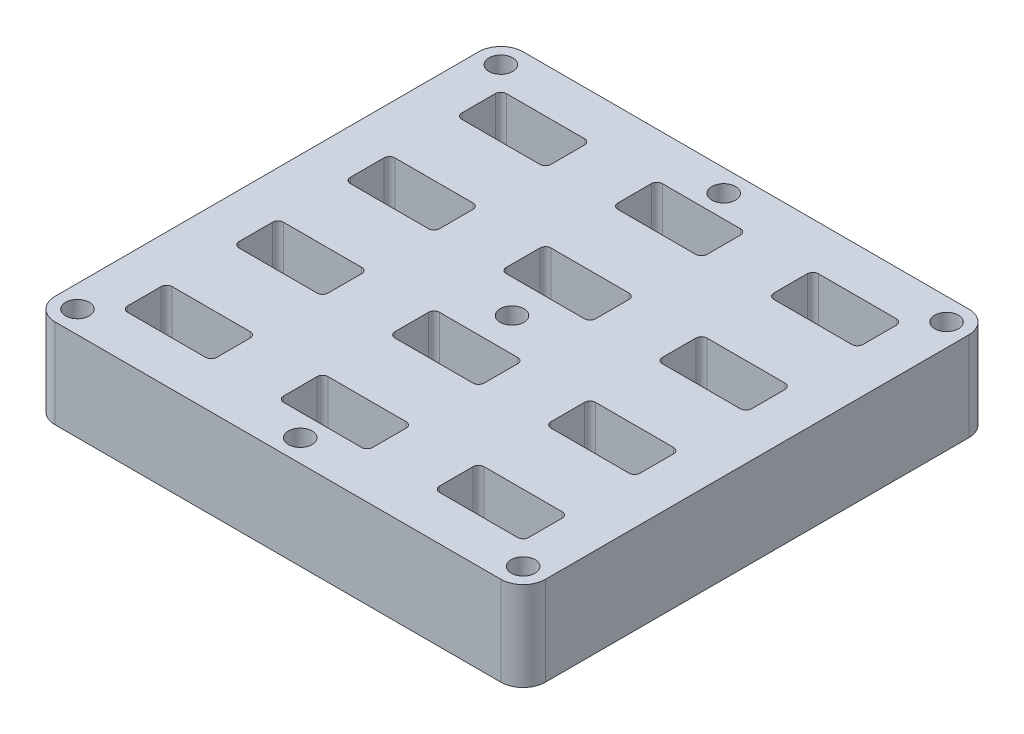
from build123d import *

# Parameters (mm, degrees)
BOSS_EXTRUDE1_DEPTH     = 25.4
F_1_4_CLEARANCE_HOLE1_D = 6.7564


with BuildPart() as part:
    # Sketch1 → Boss-Extrude1 (new body)
    with BuildSketch(Plane(origin=(0, 0, 0), x_dir=(1, 0, 0), z_dir=(0, 1, 0))):
        with BuildLine():
            Line((-63.5, -66.675), (63.5, -66.675))
            ThreePointArc((63.5, -66.675), (67.990128061, -64.815128061), (69.85, -60.325))
            Line((69.85, -60.325), (69.85, 60.325))
            ThreePointArc((69.85, 60.325), (67.990128061, 64.815128061), (63.5, 66.675))
            Line((63.5, 66.675), (-63.5, 66.675))
            ThreePointArc((-63.5, 66.675), (-67.990128061, 64.815128061), (-69.85, 60.325))
            Line((-69.85, 60.325), (-69.85, -60.325))
            ThreePointArc((-69.85, -60.325), (-67.990128061, -64.815128061), (-63.5, -66.675))
        make_face()
        with BuildLine():
            Line((-55.5625, 41.275), (-33.3375, 41.275))
            ThreePointArc((-33.3375, 41.275), (-32.214967985, 41.739967985), (-31.75, 42.8625))
            Line((-31.75, 42.8625), (-31.75, 52.3875))
            ThreePointArc((-31.75, 52.3875), (-32.214967985, 53.510032015), (-33.3375, 53.975))
            Line((-33.3375, 53.975), (-55.5625, 53.975))
            ThreePointArc((-55.5625, 53.975), (-56.685032015, 53.510032015), (-57.15, 52.3875))
            Line((-57.15, 52.3875), (-57.15, 42.8625))
            ThreePointArc((-57.15, 42.8625), (-56.685032015, 41.739967985), (-55.5625, 41.275))
        make_face(mode=Mode.SUBTRACT)
        with BuildLine():
            Line((-12.7, 42.8625), (-12.7, 52.3875))
            ThreePointArc((-12.7, 52.3875), (-12.235032015, 53.510032015), (-11.1125, 53.975))
            Line((-11.1125, 53.975), (11.1125, 53.975))
            ThreePointArc((11.1125, 53.975), (12.235032015, 53.510032015), (12.7, 52.3875))
            Line((12.7, 52.3875), (12.7, 42.8625))
            ThreePointArc((12.7, 42.8625), (12.235032015, 41.739967985), (11.1125, 41.275))
            Line((11.1125, 41.275), (-11.1125, 41.275))
            ThreePointArc((-11.1125, 41.275), (-12.235032015, 41.739967985), (-12.7, 42.8625))
        make_face(mode=Mode.SUBTRACT)
        with BuildLine():
            Line((31.75, 42.8625), (31.75, 52.3875))
            ThreePointArc((31.75, 52.3875), (32.214967985, 53.510032015), (33.3375, 53.975))
            Line((33.3375, 53.975), (55.5625, 53.975))
            ThreePointArc((55.5625, 53.975), (56.685032015, 53.510032015), (57.15, 52.3875))
            Line((57.15, 52.3875), (57.15, 42.8625))
            ThreePointArc((57.15, 42.8625), (56.685032015, 41.739967985), (55.5625, 41.275))
            Line((55.5625, 41.275), (33.3375, 41.275))
            ThreePointArc((33.3375, 41.275), (32.214967985, 41.739967985), (31.75, 42.8625))
        make_face(mode=Mode.SUBTRACT)
        with BuildLine():
            Line((-57.15, 11.1125), (-57.15, 20.6375))
            ThreePointArc((-57.15, 20.6375), (-56.685032015, 21.760032015), (-55.5625, 22.225))
            Line((-55.5625, 22.225), (-33.3375, 22.225))
            ThreePointArc((-33.3375, 22.225), (-32.214967985, 21.760032015), (-31.75, 20.6375))
            Line((-31.75, 20.6375), (-31.75, 11.1125))
            ThreePointArc((-31.75, 11.1125), (-32.214967985, 9.989967985), (-33.3375, 9.525))
            Line((-33.3375, 9.525), (-55.5625, 9.525))
            ThreePointArc((-55.5625, 9.525), (-56.685032015, 9.989967985), (-57.15, 11.1125))
        make_face(mode=Mode.SUBTRACT)
        with BuildLine():
            Line((-12.7, 11.1125), (-12.7, 20.6375))
            ThreePointArc((-12.7, 20.6375), (-12.235032015, 21.760032015), (-11.1125, 22.225))
            Line((-11.1125, 22.225), (11.1125, 22.225))
            ThreePointArc((11.1125, 22.225), (12.235032015, 21.760032015), (12.7, 20.6375))
            Line((12.7, 20.6375), (12.7, 11.1125))
            ThreePointArc((12.7, 11.1125), (12.235032015, 9.989967985), (11.1125, 9.525))
            Line((11.1125, 9.525), (-11.1125, 9.525))
            ThreePointArc((-11.1125, 9.525), (-12.235032015, 9.989967985), (-12.7, 11.1125))
        make_face(mode=Mode.SUBTRACT)
        with BuildLine():
            Line((31.75, 11.1125), (31.75, 20.6375))
            ThreePointArc((31.75, 20.6375), (32.214967985, 21.760032015), (33.3375, 22.225))
            Line((33.3375, 22.225), (55.5625, 22.225))
            ThreePointArc((55.5625, 22.225), (56.685032015, 21.760032015), (57.15, 20.6375))
            Line((57.15, 20.6375), (57.15, 11.1125))
            ThreePointArc((57.15, 11.1125), (56.685032015, 9.989967985), (55.5625, 9.525))
            Line((55.5625, 9.525), (33.3375, 9.525))
            ThreePointArc((33.3375, 9.525), (32.214967985, 9.989967985), (31.75, 11.1125))
        make_face(mode=Mode.SUBTRACT)
        with BuildLine():
            Line((-57.15, -20.6375), (-57.15, -11.1125))
            ThreePointArc((-57.15, -11.1125), (-56.685032015, -9.989967985), (-55.5625, -9.525))
            Line((-55.5625, -9.525), (-33.3375, -9.525))
            ThreePointArc((-33.3375, -9.525), (-32.214967985, -9.989967985), (-31.75, -11.1125))
            Line((-31.75, -11.1125), (-31.75, -20.6375))
            ThreePointArc((-31.75, -20.6375), (-32.214967985, -21.760032015), (-33.3375, -22.225))
            Line((-33.3375, -22.225), (-55.5625, -22.225))
            ThreePointArc((-55.5625, -22.225), (-56.685032015, -21.760032015), (-57.15, -20.6375))
        make_face(mode=Mode.SUBTRACT)
        with BuildLine():
            Line((-12.7, -20.6375), (-12.7, -11.1125))
            ThreePointArc((-12.7, -11.1125), (-12.235032015, -9.989967985), (-11.1125, -9.525))
            Line((-11.1125, -9.525), (11.1125, -9.525))
            ThreePointArc((11.1125, -9.525), (12.235032015, -9.989967985), (12.7, -11.1125))
            Line((12.7, -11.1125), (12.7, -20.6375))
            ThreePointArc((12.7, -20.6375), (12.235032015, -21.760032015), (11.1125, -22.225))
            Line((11.1125, -22.225), (-11.1125, -22.225))
            ThreePointArc((-11.1125, -22.225), (-12.235032015, -21.760032015), (-12.7, -20.6375))
        make_face(mode=Mode.SUBTRACT)
        with BuildLine():
            Line((31.75, -20.6375), (31.75, -11.1125))
            ThreePointArc((31.75, -11.1125), (32.214967985, -9.989967985), (33.3375, -9.525))
            Line((33.3375, -9.525), (55.5625, -9.525))
            ThreePointArc((55.5625, -9.525), (56.685032015, -9.989967985), (57.15, -11.1125))
            Line((57.15, -11.1125), (57.15, -20.6375))
            ThreePointArc((57.15, -20.6375), (56.685032015, -21.760032015), (55.5625, -22.225))
            Line((55.5625, -22.225), (33.3375, -22.225))
            ThreePointArc((33.3375, -22.225), (32.214967985, -21.760032015), (31.75, -20.6375))
        make_face(mode=Mode.SUBTRACT)
        with BuildLine():
            Line((-57.15, -52.3875), (-57.15, -42.8625))
            ThreePointArc((-57.15, -42.8625), (-56.685032015, -41.739967985), (-55.5625, -41.275))
            Line((-55.5625, -41.275), (-33.3375, -41.275))
            ThreePointArc((-33.3375, -41.275), (-32.214967985, -41.739967985), (-31.75, -42.8625))
            Line((-31.75, -42.8625), (-31.75, -52.3875))
            ThreePointArc((-31.75, -52.3875), (-32.214967985, -53.510032015), (-33.3375, -53.975))
            Line((-33.3375, -53.975), (-55.5625, -53.975))
            ThreePointArc((-55.5625, -53.975), (-56.685032015, -53.510032015), (-57.15, -52.3875))
        make_face(mode=Mode.SUBTRACT)
        with BuildLine():
            Line((-12.7, -52.3875), (-12.7, -42.8625))
            ThreePointArc((-12.7, -42.8625), (-12.235032015, -41.739967985), (-11.1125, -41.275))
            Line((-11.1125, -41.275), (11.1125, -41.275))
            ThreePointArc((11.1125, -41.275), (12.235032015, -41.739967985), (12.7, -42.8625))
            Line((12.7, -42.8625), (12.7, -52.3875))
            ThreePointArc((12.7, -52.3875), (12.235032015, -53.510032015), (11.1125, -53.975))
            Line((11.1125, -53.975), (-11.1125, -53.975))
            ThreePointArc((-11.1125, -53.975), (-12.235032015, -53.510032015), (-12.7, -52.3875))
        make_face(mode=Mode.SUBTRACT)
        with BuildLine():
            Line((31.75, -52.3875), (31.75, -42.8625))
            ThreePointArc((31.75, -42.8625), (32.214967985, -41.739967985), (33.3375, -41.275))
            Line((33.3375, -41.275), (55.5625, -41.275))
            ThreePointArc((55.5625, -41.275), (56.685032015, -41.739967985), (57.15, -42.8625))
            Line((57.15, -42.8625), (57.15, -52.3875))
            ThreePointArc((57.15, -52.3875), (56.685032015, -53.510032015), (55.5625, -53.975))
            Line((55.5625, -53.975), (33.3375, -53.975))
            ThreePointArc((33.3375, -53.975), (32.214967985, -53.510032015), (31.75, -52.3875))
        make_face(mode=Mode.SUBTRACT)
    extrude(amount=BOSS_EXTRUDE1_DEPTH)

    # 1/4 Clearance Hole1 (through all)
    with Locations(Plane(origin=(-63.5, 25.4, -60.325), x_dir=(0, 0, 1), z_dir=(0, 1, 0))):
        with Locations((0, 0), (0, 127), (120.65, 127), (120.65, 0), (60.325, 63.5), (0, 63.5), (120.65, 63.5)):
            Hole(F_1_4_CLEARANCE_HOLE1_D / 2)


solid = part.part
